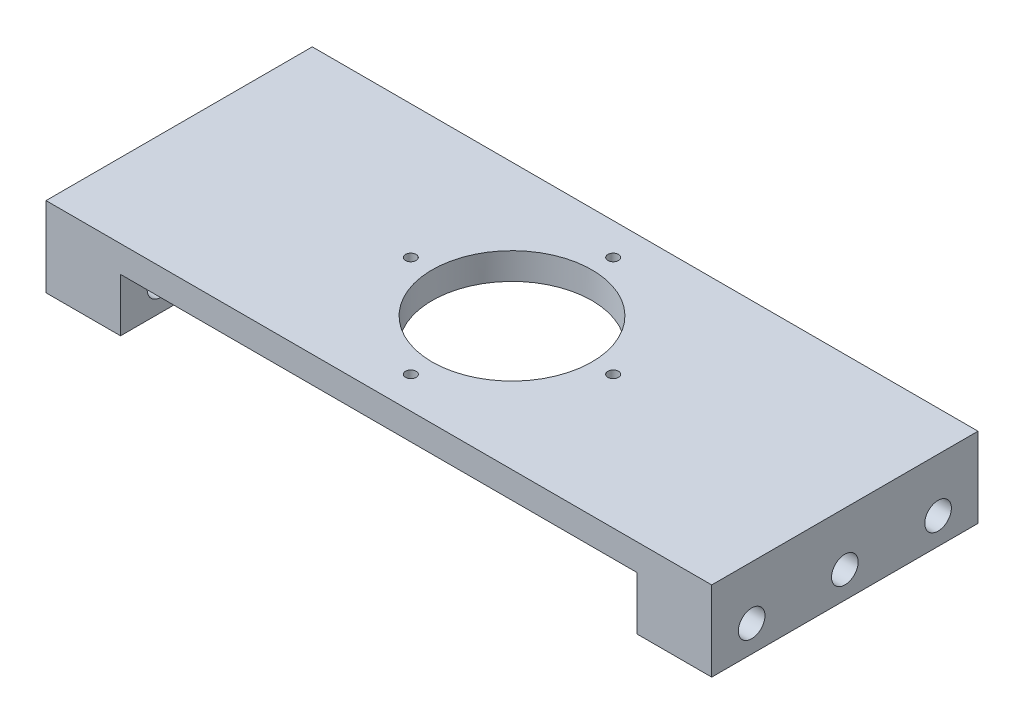
from build123d import *

# Parameters (mm, degrees)
EXTRUDE_1_DEPTH          = 10
SKETCH_2_R               = 30
CUT_EXTRUDE_1_DEPTH      = 15
SKETCH_4_W               = 28
SKETCH_4_H               = 100
EXTRUDE_2_DEPTH          = 20
SKETCH_5_R               = 5
CUT_EXTRUDE_2_DEPTH      = 30
SKETCH_6_R               = 2
CUT_EXTRUDE_4_DEPTH      = 10
PATTERN_CIRCULAR_1_COUNT = 4


with BuildPart() as part:
    # 草图1 → 凸台-拉伸1 (new body)
    with BuildSketch(Plane(origin=(0, 0, 0), x_dir=(1, 0, 0), z_dir=(0, 1, 0))):
        Polygon((0, -50), (125, -50), (125, 50), (-125, 50), (-125, -50), align=None)
    extrude(amount=EXTRUDE_1_DEPTH)

    # 草图2 → 切除-拉伸1 (cut)
    with BuildSketch(Plane(origin=(0, 10, 0), x_dir=(1, 0, 0), z_dir=(0, 1, 0))):
        with Locations(Location((0, 0, 0), (0, 0, 270))):
            Circle(SKETCH_2_R)
    extrude(amount=-CUT_EXTRUDE_1_DEPTH, mode=Mode.SUBTRACT)

    # 草图4 → 凸台-拉伸2 (add)
    with BuildSketch(Plane.XZ):
        with Locations((-111, 0)):
            Rectangle(SKETCH_4_W, SKETCH_4_H)
    extrude_2 = extrude(amount=EXTRUDE_2_DEPTH)

    # 镜向1: 凸台-拉伸2 across plane
    add(extrude_2.mirror(Plane(origin=(0, 0, 0), x_dir=(0, 0, 1), z_dir=(1, 0, 0))))

    # 草图5 → 切除-拉伸2 (cut)
    with BuildSketch(Plane(origin=(125, 0, 0), x_dir=(0, 0, -1), z_dir=(1, 0, 0))):
        with Locations((0, -10)):
            Circle(SKETCH_5_R)
        with Locations((35, -10)):
            Circle(SKETCH_5_R)
        with Locations((-35, -10)):
            Circle(SKETCH_5_R)
    cut_extrude_2 = extrude(amount=-CUT_EXTRUDE_2_DEPTH, mode=Mode.SUBTRACT)

    # 镜向2: 切除-拉伸2 across plane
    add(cut_extrude_2.mirror(Plane(origin=(0, 0, 0), x_dir=(0, 0, 1), z_dir=(1, 0, 0))), mode=Mode.SUBTRACT)

    # 草图6 → 切除-拉伸4 (cut)
    with BuildSketch(Plane(origin=(0, 10, 0), x_dir=(1, 0, 0), z_dir=(0, 1, 0))):
        with Locations(Location((0, 38, 0), (0, 0, 270))):
            Circle(SKETCH_6_R)
    cut_extrude_4 = extrude(amount=-CUT_EXTRUDE_4_DEPTH, mode=Mode.SUBTRACT)

    # 阵列(圆周)1: 切除-拉伸4 ×4 about axis
    pattern_circular_1_axis = Axis((0, 0, 0), (0, 1, 0))
    for i in range(1, PATTERN_CIRCULAR_1_COUNT):
        add(cut_extrude_4.rotate(pattern_circular_1_axis, i * 360 / PATTERN_CIRCULAR_1_COUNT), mode=Mode.SUBTRACT)


solid = part.part
